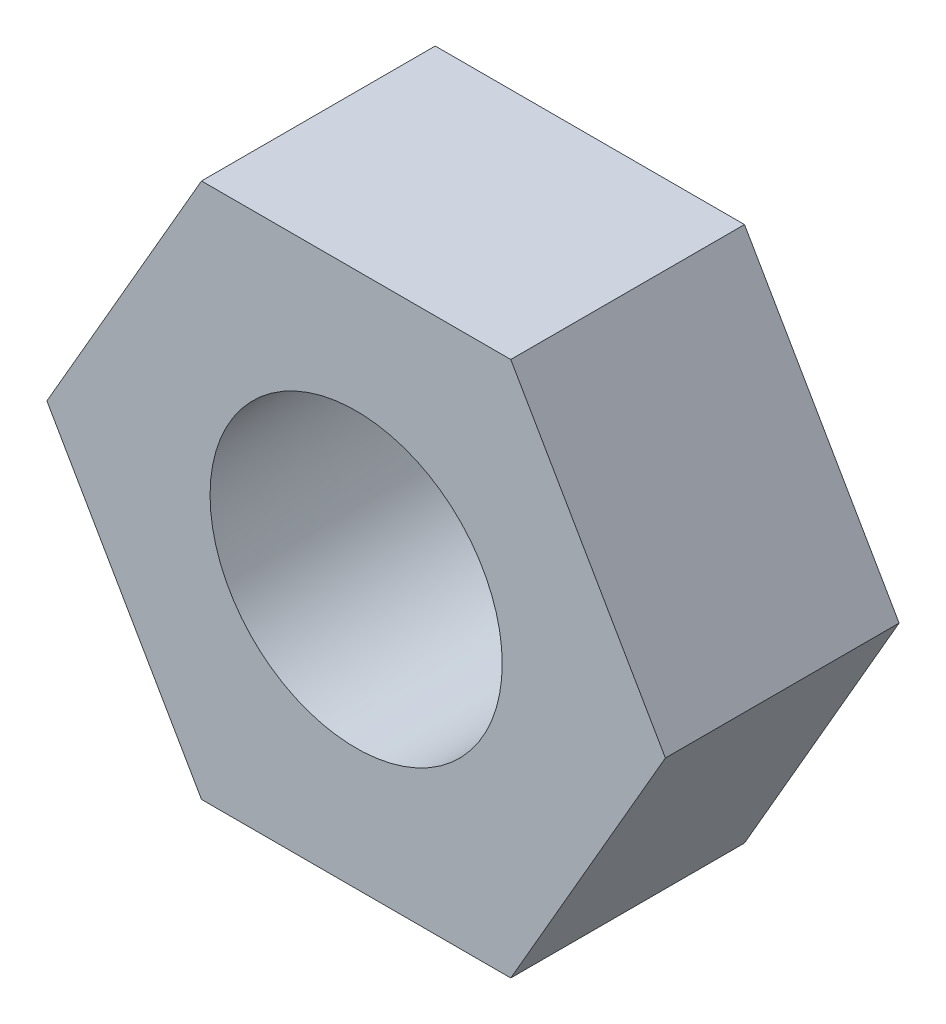
from build123d import *

# Parameters (mm, degrees)
EXTRUDE_1_DEPTH     = 2.4
CUT_EXTRUDE_1_REACH = 6.838
SKETCH_2_R          = 1.5


with BuildPart() as part:
    # 草图1 → 凸台-拉伸1 (new body)
    with BuildSketch(Plane.XY):
        Polygon((1.58771324, -2.75), (3.175426481, 0), (1.58771324, 2.75), (-1.58771324, 2.75), (-3.175426481, 0), (-1.58771324, -2.75), align=None)
    extrude(amount=EXTRUDE_1_DEPTH)

    # 草图2 → 切除-拉伸1 (cut, up to next)
    with BuildSketch(Plane.XY.offset(2.4), mode=Mode.PRIVATE) as cut_extrude_1_sk1:
        Circle(SKETCH_2_R)
    cut_extrude_1_tool1 = extrude(cut_extrude_1_sk1.sketch, amount=-CUT_EXTRUDE_1_REACH, mode=Mode.PRIVATE) & part.part
    add(cut_extrude_1_tool1.solids().sort_by_distance((0, 0, 2.4))[0], mode=Mode.SUBTRACT)


solid = part.part
